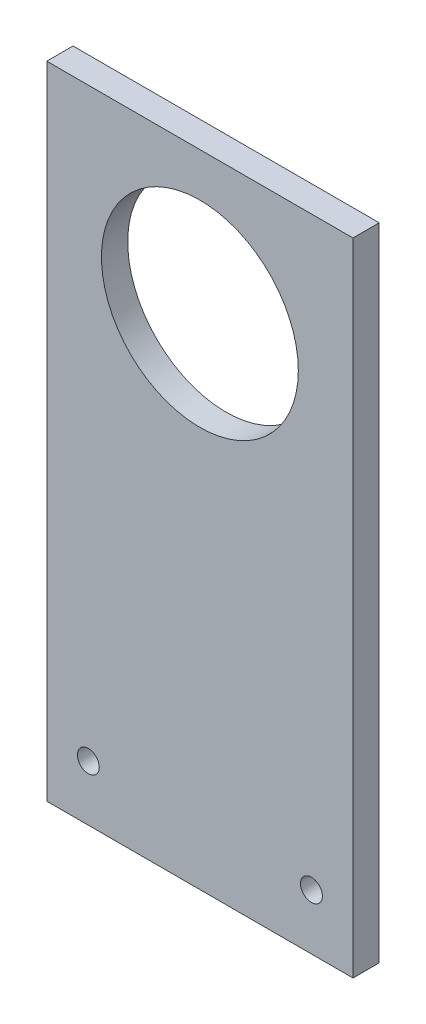
from build123d import *

# Parameters (mm, degrees)
SKETCH2_R           = 22.5
BOSS_EXTRUDE1_DEPTH = 3
SKETCH3_R           = 2.5
CUT_EXTRUDE1_DEPTH  = 6


with BuildPart() as part:
    # Sketch2 → Boss-Extrude1 (new, symmetric)
    with BuildSketch(Plane.XY):
        Polygon((-35, 0), (35, 0), (35, 114), (35, 146.5), (-35, 146.5), (-35, 114), align=None)
        with Locations((0, 114)):
            Circle(SKETCH2_R, mode=Mode.SUBTRACT)
    extrude(amount=BOSS_EXTRUDE1_DEPTH, both=True)

    # Sketch3 → Cut-Extrude1 (cut)
    with BuildSketch(Plane.XY.offset(3)):
        with Locations((-25.5, 12.7)):
            Circle(SKETCH3_R)
        with Locations((25.5, 12.7)):
            Circle(SKETCH3_R)
    extrude(amount=-CUT_EXTRUDE1_DEPTH, mode=Mode.SUBTRACT)


solid = part.part
